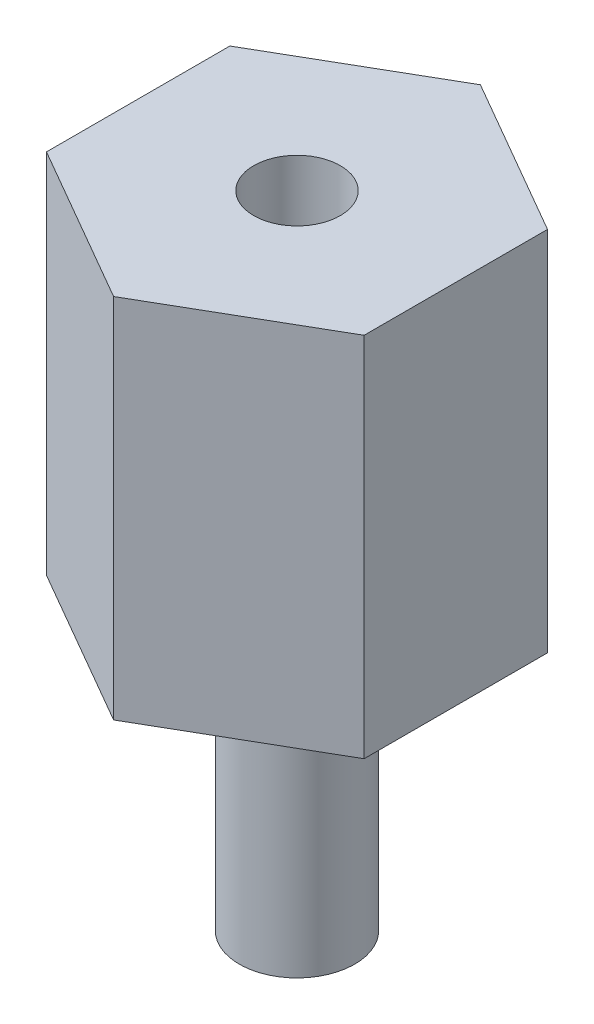
from build123d import *

# Parameters (mm, degrees)
BOSS_EXTRUDE1_DEPTH = 12.7
SKETCH2_R           = 1.5
CUT_EXTRUDE1_DEPTH  = 3.2
SKETCH3_R           = 2
BOSS_EXTRUDE2_DEPTH = 9.5


with BuildPart() as part:
    # Sketch1 → Boss-Extrude1 (new body)
    with BuildSketch(Plane(origin=(0, 0, 0), x_dir=(1, 0, 0), z_dir=(0, 1, 0))):
        Polygon((0, 6.350852961), (-5.5, 3.175426481), (-5.5, -3.175426481), (0, -6.350852961), (5.5, -3.175426481), (5.5, 3.175426481), align=None)
    extrude(amount=BOSS_EXTRUDE1_DEPTH)

    # Sketch2 → Cut-Extrude1 (cut)
    with BuildSketch(Plane(origin=(0, 12.7, 0), x_dir=(1, 0, 0), z_dir=(0, 1, 0))):
        with Locations(Location((0, 0, 0), (0, 0, 270))):
            Circle(SKETCH2_R)
    extrude(amount=-CUT_EXTRUDE1_DEPTH, mode=Mode.SUBTRACT)

    # Sketch3 → Boss-Extrude2 (add)
    with BuildSketch(Plane.XZ):
        with Locations(Location((0, 0, 0), (0, 0, 270))):
            Circle(SKETCH3_R)
    extrude(amount=BOSS_EXTRUDE2_DEPTH)


solid = part.part
